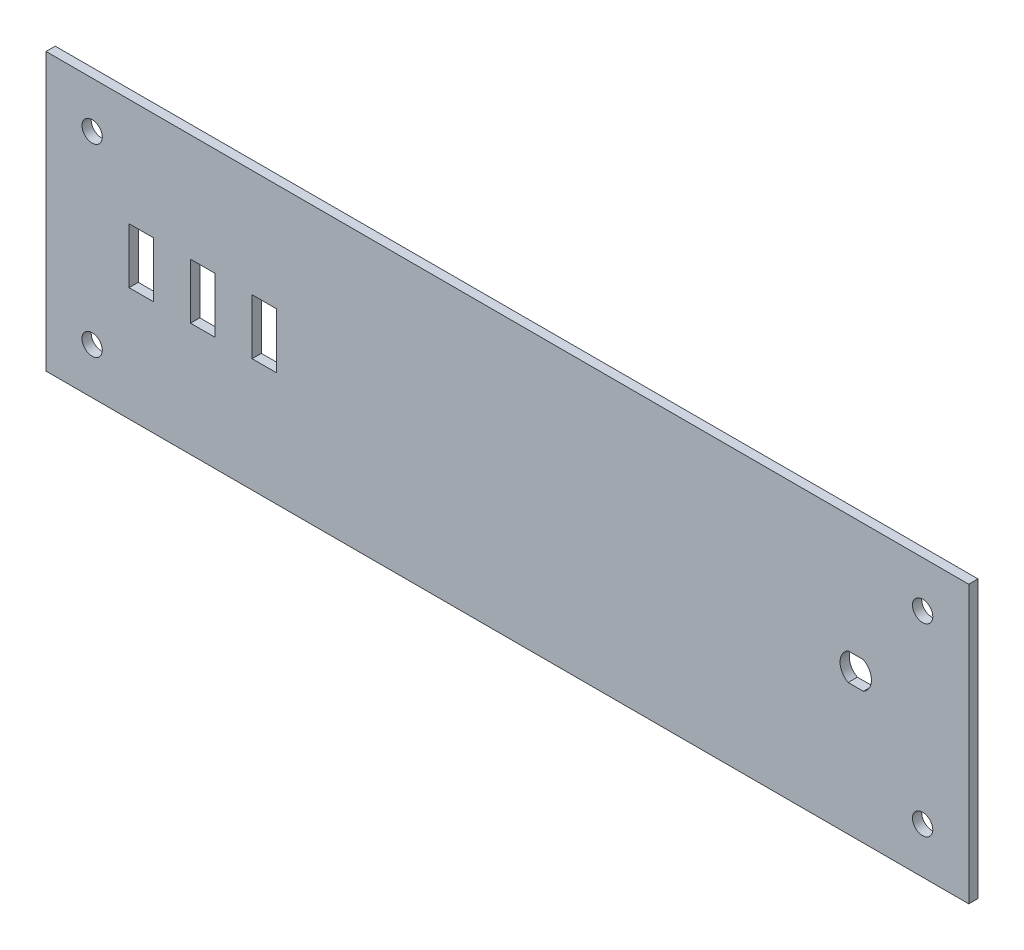
from build123d import *

# Parameters (mm, degrees)
SKIZZE1_W                       = 300
SKIZZE1_H                       = 90.0015
AUFSATZ_LINEAR_AUSTRAGEN1_DEPTH = 3
DURCHGANGSLOCH_F_R_M61_D        = 6.6
SKIZZE4_W                       = 8
SKIZZE4_H                       = 18
SCHNITT_LINEAR_AUSTRAGEN1_DEPTH = 10
SCHNITT_LINEAR_AUSTRAGEN2_DEPTH = 10


with BuildPart() as part:
    # Skizze1 → Aufsatz-Linear austragen1 (new body)
    with BuildSketch(Plane.XY):
        with Locations((-150, -29.999999991)):
            Rectangle(SKIZZE1_W, SKIZZE1_H)
    extrude(amount=AUFSATZ_LINEAR_AUSTRAGEN1_DEPTH)

    # Durchgangsloch für M61 (through all)
    with Locations(Plane.XY.offset(3)):
        with Locations((-15, 0.000750009), (-15, -60.000749991), (-285, -60.000749991), (-285, 0.000750009)):
            Hole(DURCHGANGSLOCH_F_R_M61_D / 2)

    # Skizze4 → Schnitt-Linear austragen1 (cut)
    with BuildSketch(Plane.XY.offset(3)):
        with Locations((-269, -28.999249991)):
            Rectangle(SKIZZE4_W, SKIZZE4_H)
        with Locations((-249, -28.999249991)):
            Rectangle(SKIZZE4_W, SKIZZE4_H)
        with Locations((-229, -28.999249991)):
            Rectangle(SKIZZE4_W, SKIZZE4_H)
    extrude(amount=-SCHNITT_LINEAR_AUSTRAGEN1_DEPTH, mode=Mode.SUBTRACT)

    # Skizze5 → Schnitt-Linear austragen2 (cut)
    with BuildSketch(Plane.XY.offset(3)):
        with BuildLine():
            Line((-34.255252171, -23.380072644), (-39.238223172, -23.380072644))
            ThreePointArc((-39.238223172, -23.380072644), (-41.846737672, -27.830072644), (-39.238223172, -32.280072644))
            Line((-39.238223172, -32.280072644), (-34.255252171, -32.280072644))
            ThreePointArc((-34.255252171, -32.280072644), (-31.646737672, -27.830072644), (-34.255252171, -23.380072644))
        make_face()
    extrude(amount=-SCHNITT_LINEAR_AUSTRAGEN2_DEPTH, mode=Mode.SUBTRACT)


solid = part.part
